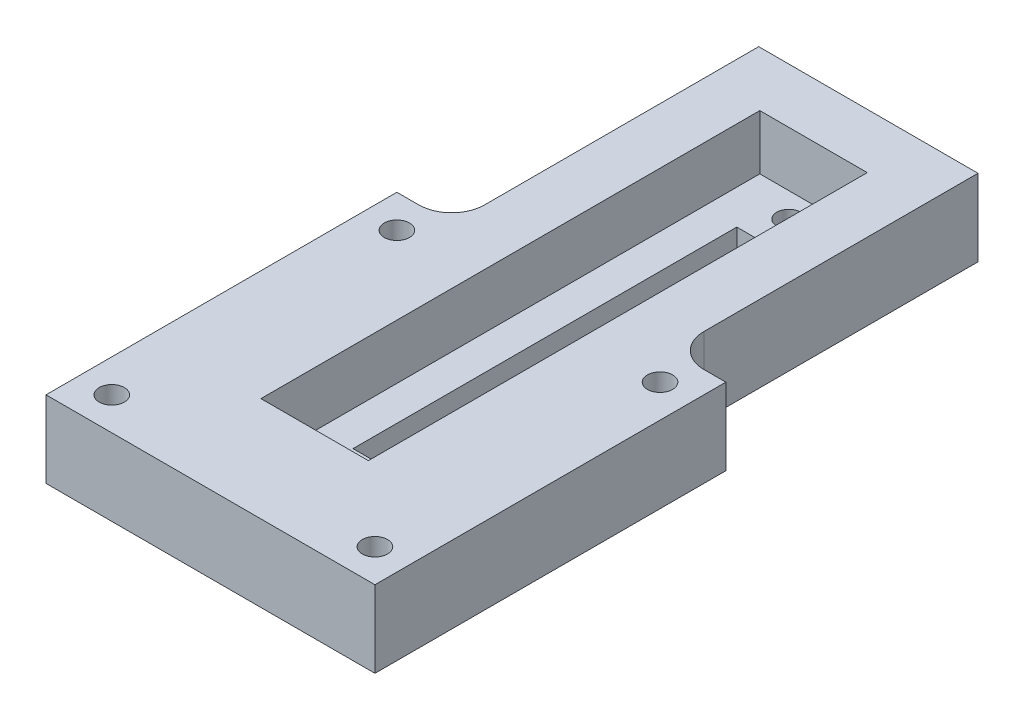
from build123d import *

# Parameters (mm, degrees)
SKETCH_1_W          = 20
SKETCH_1_H          = 60
EXTRUDE_1_DEPTH     = 7
SKETCH_4_W          = 30
SKETCH_4_H          = 32
EXTRUDE_2_DEPTH     = 7
SKETCH_3_W          = 9.8
SKETCH_3_H          = 45.5
CUT_EXTRUDE_1_DEPTH = 5
SKETCH_5_W          = 3.5
SKETCH_5_H          = 35
CUT_EXTRUDE_2_DEPTH = 34.911649916
SKETCH_6_R          = 1.1
CUT_EXTRUDE_3_DEPTH = 34.911649916
SKETCH_7_R          = 1.15
CUT_EXTRUDE_4_DEPTH = 35.263683398
FILLET_1_R          = 3
SKETCH_8_R          = 1.95
CUT_EXTRUDE_5_DEPTH = 1


with BuildPart() as part:
    # 草图1 → 凸台-拉伸1 (new body)
    with BuildSketch(Plane(origin=(0, 0, 0), x_dir=(1, 0, 0), z_dir=(0, 1, 0))):
        Rectangle(SKETCH_1_W, SKETCH_1_H)
    extrude(amount=EXTRUDE_1_DEPTH)

    # 草图4 → 凸台-拉伸2 (add)
    with BuildSketch(Plane.XZ):
        with Locations((0, 14)):
            Rectangle(SKETCH_4_W, SKETCH_4_H)
    extrude(amount=-EXTRUDE_2_DEPTH)

    # 草图3 → 切除-拉伸1 (cut)
    with BuildSketch(Plane(origin=(0, 7, 0), x_dir=(1, 0, 0), z_dir=(0, 1, 0))):
        with Locations((0, 2.25)):
            Rectangle(SKETCH_3_W, SKETCH_3_H)
    extrude(amount=-CUT_EXTRUDE_1_DEPTH, mode=Mode.SUBTRACT)

    # 草图5 → 切除-拉伸2 (cut, through all)
    with BuildSketch(Plane(origin=(0, 2, 0), x_dir=(1, 0, 0), z_dir=(0, 1, 0))):
        with Locations((0, 2.25)):
            Rectangle(SKETCH_5_W, SKETCH_5_H)
    extrude(amount=-CUT_EXTRUDE_2_DEPTH, mode=Mode.SUBTRACT)

    # 草图6 → 切除-拉伸3 (cut, through all)
    with BuildSketch(Plane(origin=(0, 2, 0), x_dir=(1, 0, 0), z_dir=(0, 1, 0))):
        with Locations(Location((0, 22.75, 0), (0, 0, 270))):
            Circle(SKETCH_6_R)
        with Locations(Location((0, -18.25, 0), (0, 0, 90))):
            Circle(SKETCH_6_R)
    extrude(amount=-CUT_EXTRUDE_3_DEPTH, mode=Mode.SUBTRACT)

    # 草图7 → 切除-拉伸4 (cut, through all)
    with BuildSketch(Plane(origin=(0, 7, 0), x_dir=(1, 0, 0), z_dir=(0, 1, 0))):
        with Locations(Location((-12, -1, 0), (0, 0, 270))):
            Circle(SKETCH_7_R)
        with Locations(Location((12, -1, 0), (0, 0, 90))):
            Circle(SKETCH_7_R)
        with Locations(Location((12, -27, 0), (0, 0, 270))):
            Circle(SKETCH_7_R)
        with Locations(Location((-12, -27, 0), (0, 0, 90))):
            Circle(SKETCH_7_R)
    extrude(amount=-CUT_EXTRUDE_4_DEPTH, mode=Mode.SUBTRACT)

    # 圆角1
    fillet_1_edges = [part.edges().sort_by_distance(p)[0] for p in [
        (10, 3.5, -2),
        (-10, 3.5, -2),
    ]]
    fillet(fillet_1_edges, radius=FILLET_1_R)

    # 草图8 → 切除-拉伸5 (cut)
    with BuildSketch(Plane.XZ):
        with Locations(Location((0, 18.25, 0), (0, 0, 270))):
            Circle(SKETCH_8_R)
        with Locations(Location((0, -22.75, 0), (0, 0, 270))):
            Circle(SKETCH_8_R)
    extrude(amount=-CUT_EXTRUDE_5_DEPTH, mode=Mode.SUBTRACT)


solid = part.part
